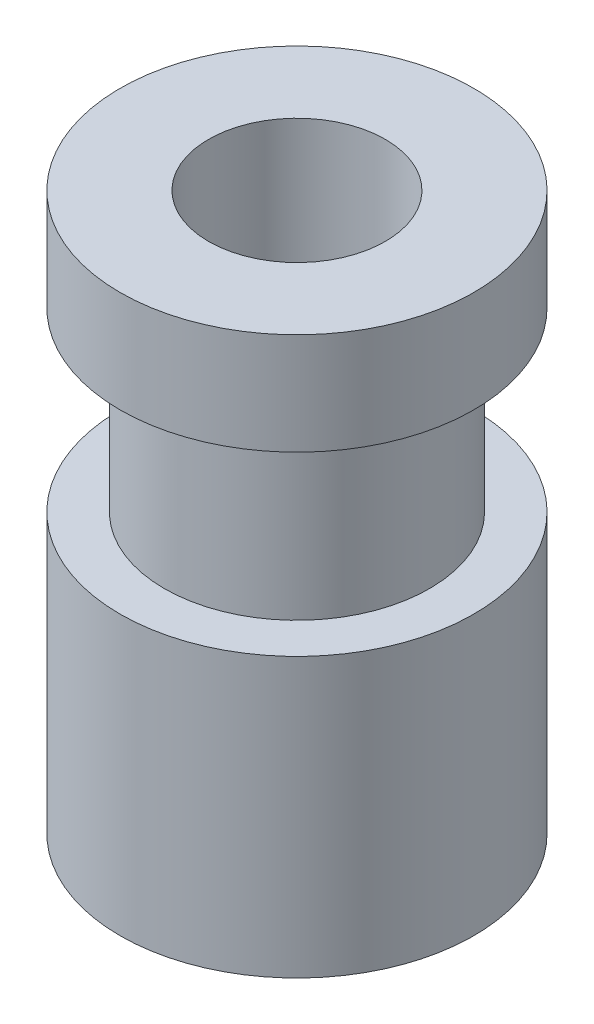
from build123d import *

# Parameters (mm, degrees)
SKETCH1_R           = 10
BOSS_EXTRUDE2_DEPTH = 10
CUT_EXTRUDE3_REACH  = 19.321
SKETCH5_R           = 1.5
SKETCH6_R           = 10
BOSS_EXTRUDE3_DEPTH = 5.75
SKETCH7_R           = 5
CUT_EXTRUDE4_DEPTH  = 5.75
SKETCH8_R           = 7.5
BOSS_EXTRUDE4_DEPTH = 10
SKETCH9_R           = 10
BOSS_EXTRUDE5_DEPTH = 5.75
CUT_EXTRUDE5_REACH  = 36.529
SKETCH10_R          = 5


with BuildPart() as part:
    # Sketch1 → Boss-Extrude2 (new body)
    with BuildSketch(Plane(origin=(0, 0, 0), x_dir=(1, 0, 0), z_dir=(0, 1, 0))):
        with Locations(Location((0, 0, 0), (0, 0, 270))):
            Circle(SKETCH1_R)
    extrude(amount=BOSS_EXTRUDE2_DEPTH)

    # Sketch5 → Cut-Extrude3 (cut, up to next)
    with BuildSketch(Plane(origin=(0, 10, 0), x_dir=(-1, 0, 0), z_dir=(0, 1, 0)), mode=Mode.PRIVATE) as cut_extrude3_sk1:
        with Locations(Location((0, 0, 0), (0, 0, 90))):
            Circle(SKETCH5_R)
    cut_extrude3_tool1 = extrude(cut_extrude3_sk1.sketch, amount=-CUT_EXTRUDE3_REACH, mode=Mode.PRIVATE) & part.part
    add(cut_extrude3_tool1.solids().sort_by_distance((0, 10, 0))[0], mode=Mode.SUBTRACT)

    # Sketch6 → Boss-Extrude3 (add)
    with BuildSketch(Plane(origin=(0, 10, 0), x_dir=(-1, 0, 0), z_dir=(0, 1, 0))):
        with Locations(Location((0, 0, 0), (0, 0, 90))):
            Circle(SKETCH6_R)
    extrude(amount=BOSS_EXTRUDE3_DEPTH)

    # Sketch7 → Cut-Extrude4 (cut)
    with BuildSketch(Plane(origin=(0, 15.75, 0), x_dir=(-1, 0, 0), z_dir=(0, 1, 0))):
        with Locations(Location((0, 0, 0), (0, 0, 90))):
            Circle(SKETCH7_R)
    extrude(amount=-CUT_EXTRUDE4_DEPTH, mode=Mode.SUBTRACT)

    # Sketch8 → Boss-Extrude4 (add)
    with BuildSketch(Plane(origin=(0, 15.75, 0), x_dir=(-1, 0, 0), z_dir=(0, 1, 0))):
        with Locations(Location((0, 0, 0), (0, 0, 90))):
            Circle(SKETCH8_R)
    extrude(amount=BOSS_EXTRUDE4_DEPTH)

    # Sketch9 → Boss-Extrude5 (add)
    with BuildSketch(Plane(origin=(0, 25.75, 0), x_dir=(-1, 0, 0), z_dir=(0, 1, 0))):
        with Locations(Location((0, 0, 0), (0, 0, 90))):
            Circle(SKETCH9_R)
    extrude(amount=BOSS_EXTRUDE5_DEPTH)

    # Sketch10 → Cut-Extrude5 (cut, up to next)
    with BuildSketch(Plane(origin=(0, 31.5, 0), x_dir=(-1, 0, 0), z_dir=(0, 1, 0)), mode=Mode.PRIVATE) as cut_extrude5_sk1:
        with Locations(Location((0, 0, 0), (0, 0, 90))):
            Circle(SKETCH10_R)
    cut_extrude5_tool1 = extrude(cut_extrude5_sk1.sketch, amount=-CUT_EXTRUDE5_REACH, mode=Mode.PRIVATE) & part.part
    add(cut_extrude5_tool1.solids().sort_by_distance((0, 31.5, 0))[0], mode=Mode.SUBTRACT)


solid = part.part
